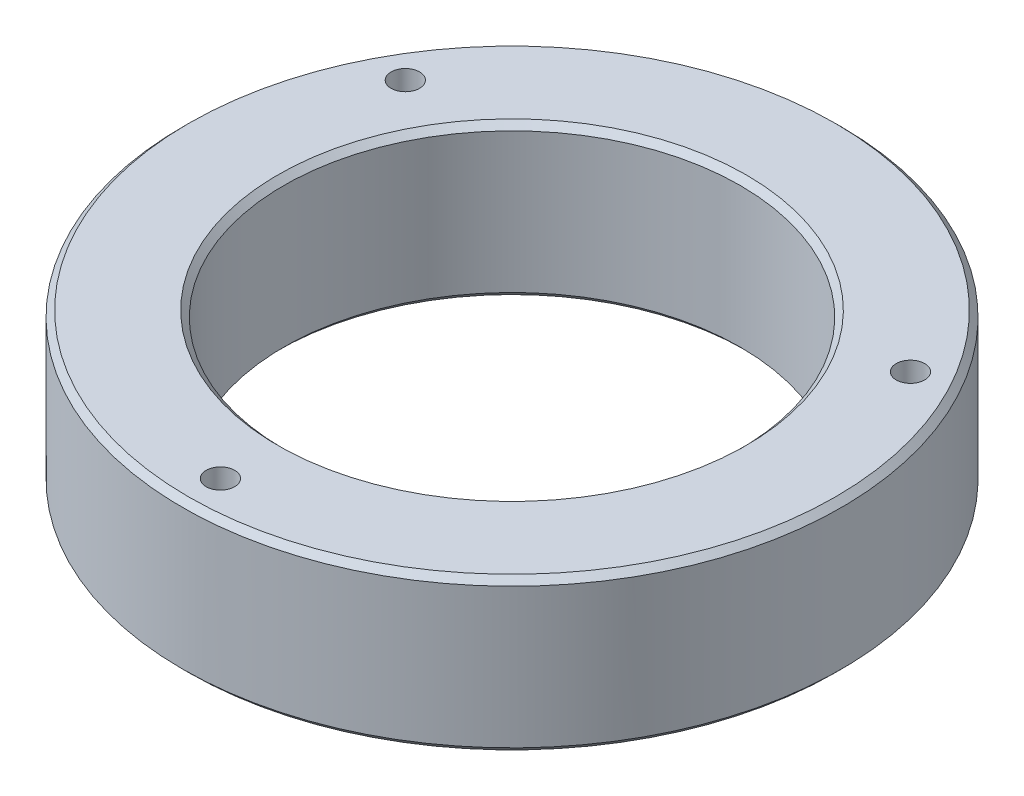
from build123d import *

# Parameters (mm, degrees)
SKETCH1_W                                        = 38.1
SKETCH1_H                                        = 25.3746
CHAMFER1_SIZE                                    = 1.524
CBORE_FOR_1_4_SOCKET_HEAD_CAP_SCREW1_D           = 7.1374
CBORE_FOR_1_4_SOCKET_HEAD_CAP_SCREW1_DEPTH       = 38.1
CBORE_FOR_1_4_SOCKET_HEAD_CAP_SCREW1_CBORE_D     = 11.1252
CBORE_FOR_1_4_SOCKET_HEAD_CAP_SCREW1_CBORE_DEPTH = 9.652
CBORE_FOR_1_4_SOCKET_HEAD_CAP_SCREW1_TIP         = 2.144291291
F_3_8_16_TAPPED_HOLE2_D                          = 7.9375
F_3_8_16_TAPPED_HOLE2_DEPTH                      = 25.4
F_3_8_16_TAPPED_HOLE2_TIP                        = 2.384665582


with BuildPart() as part:
    # Sketch1 → Revolve1 (revolve)
    with BuildSketch(Plane(origin=(0, 0, 0), x_dir=(0, 1, 0), z_dir=(0, 0, 1)), mode=Mode.PRIVATE) as revolve1_sk:
        with Locations((0, 69.8373)):
            Rectangle(SKETCH1_W, SKETCH1_H)
    revolve(revolve1_sk.sketch.rotate(Axis((0, -44.45, 0), (0, 1, 0)), 270), axis=Axis((0, -44.45, 0), (0, 1, 0)))

    # Chamfer1
    chamfer1_edges = [part.edges().sort_by_distance(p)[0] for p in [
        (0, -19.05, 57.15),
        (0, 19.05, 57.15),
        (0, 19.05, 82.5246),
        (0, -19.05, 82.5246),
    ]]
    chamfer(chamfer1_edges, length=CHAMFER1_SIZE)

    # CBORE for 1/4 Socket Head Cap Screw1
    with Locations(Plane(origin=(0, -19.05, 0), x_dir=(-1, 0, 0), z_dir=(0, -1, 0))):
        with Locations((0, -73.025), (-63.246, 36.5252), (63.246, 36.5252)):
            CounterBoreHole(CBORE_FOR_1_4_SOCKET_HEAD_CAP_SCREW1_D / 2, CBORE_FOR_1_4_SOCKET_HEAD_CAP_SCREW1_CBORE_D / 2, CBORE_FOR_1_4_SOCKET_HEAD_CAP_SCREW1_CBORE_DEPTH, depth=CBORE_FOR_1_4_SOCKET_HEAD_CAP_SCREW1_DEPTH)
            with Locations((0, 0, -(CBORE_FOR_1_4_SOCKET_HEAD_CAP_SCREW1_DEPTH + CBORE_FOR_1_4_SOCKET_HEAD_CAP_SCREW1_TIP / 2))):  # 118° drill point
                Cone(0, CBORE_FOR_1_4_SOCKET_HEAD_CAP_SCREW1_D / 2, CBORE_FOR_1_4_SOCKET_HEAD_CAP_SCREW1_TIP, mode=Mode.SUBTRACT)

    # 3/8-16 Tapped Hole2
    with Locations(Plane(origin=(0, -19.05, 0), x_dir=(-1, 0, 0), z_dir=(0, -1, 0))):
        with Locations((-69.85, 0), (69.85, 0)):
            Hole(F_3_8_16_TAPPED_HOLE2_D / 2, depth=F_3_8_16_TAPPED_HOLE2_DEPTH)
            with Locations((0, 0, -(F_3_8_16_TAPPED_HOLE2_DEPTH + F_3_8_16_TAPPED_HOLE2_TIP / 2))):  # 118° drill point
                Cone(0, F_3_8_16_TAPPED_HOLE2_D / 2, F_3_8_16_TAPPED_HOLE2_TIP, mode=Mode.SUBTRACT)


solid = part.part
